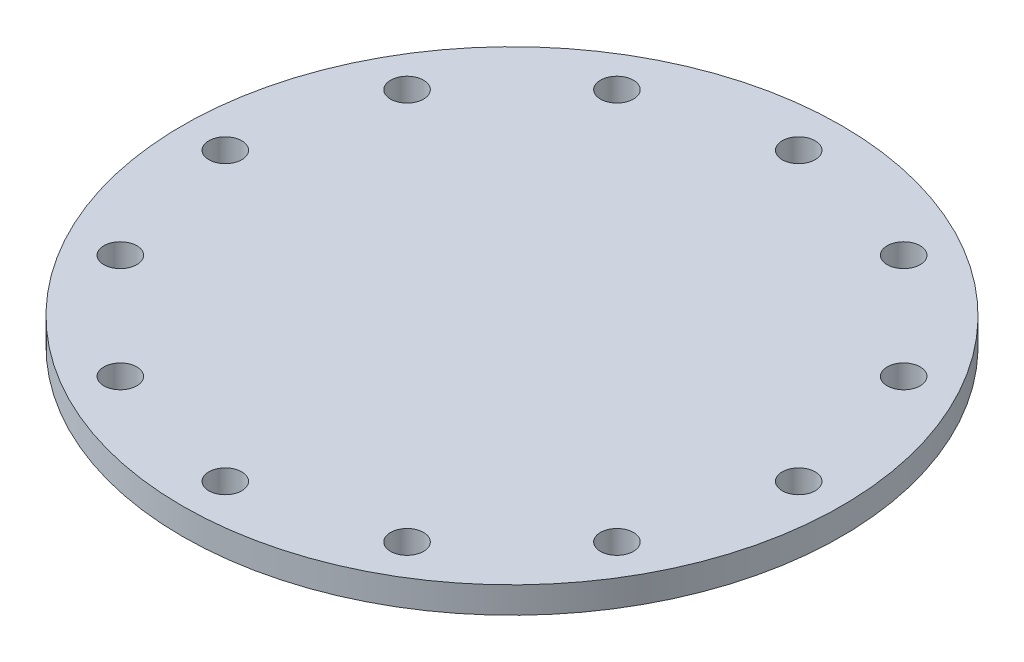
from build123d import *

# Parameters (mm, degrees)
SKETCH1_R           = 250
BOSS_EXTRUDE1_DEPTH = 20
SKETCH2_R           = 12.5
CUT_EXTRUDE1_DEPTH  = 20


with BuildPart() as part:
    # Sketch1 → Boss-Extrude1 (new body)
    with BuildSketch(Plane(origin=(0, 0, 0), x_dir=(1, 0, 0), z_dir=(0, 1, 0))):
        with Locations(Location((0, 0, 0), (0, 0, 270))):
            Circle(SKETCH1_R)
    extrude(amount=BOSS_EXTRUDE1_DEPTH)

    # Sketch2 → Cut-Extrude1 (cut)
    with BuildSketch(Plane(origin=(0, 20, 0), x_dir=(1, 0, 0), z_dir=(0, 1, 0))):
        with Locations(Location((0, 217.5, 0), (0, 0, 270))):
            Circle(SKETCH2_R)
        with Locations(Location((108.75, 188.360525323, 0), (0, 0, 270))):
            Circle(SKETCH2_R)
        with Locations(Location((188.360525323, 108.75, 0), (0, 0, 270))):
            Circle(SKETCH2_R)
        with Locations(Location((217.5, 0, 0), (0, 0, 270))):
            Circle(SKETCH2_R)
        with Locations(Location((188.360525323, -108.75, 0), (0, 0, 270))):
            Circle(SKETCH2_R)
        with Locations(Location((108.75, -188.360525323, 0), (0, 0, 270))):
            Circle(SKETCH2_R)
        with Locations(Location((0, -217.5, 0), (0, 0, 270))):
            Circle(SKETCH2_R)
        with Locations(Location((-108.75, -188.360525323, 0), (0, 0, 270))):
            Circle(SKETCH2_R)
        with Locations(Location((-188.360525323, -108.75, 0), (0, 0, 270))):
            Circle(SKETCH2_R)
        with Locations(Location((-217.5, 0, 0), (0, 0, 270))):
            Circle(SKETCH2_R)
        with Locations(Location((-188.360525323, 108.75, 0), (0, 0, 270))):
            Circle(SKETCH2_R)
        with Locations(Location((-108.75, 188.360525323, 0), (0, 0, 270))):
            Circle(SKETCH2_R)
    extrude(amount=-CUT_EXTRUDE1_DEPTH, mode=Mode.SUBTRACT)


solid = part.part
